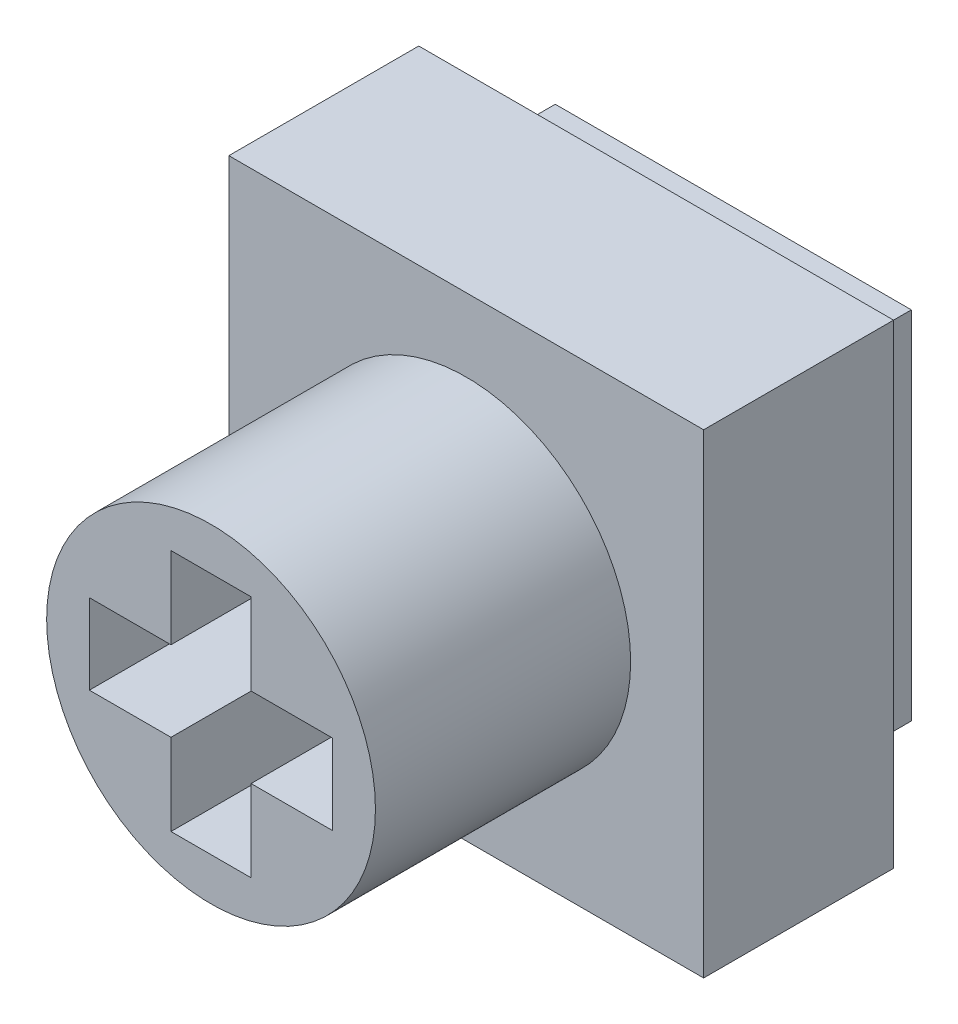
from build123d import *

# Parameters (mm, degrees)
BOSS_EXTRUDE1_DEPTH = 7.5
SKETCH7_W           = 8
SKETCH7_H           = 8
BOSS_EXTRUDE2_DEPTH = 3.2
SKETCH8_W           = 6
SKETCH8_H           = 6
BOSS_EXTRUDE3_DEPTH = 1.3


with BuildPart() as part:
    # Sketch6 → Boss-Extrude1 (new body)
    with BuildSketch(Plane(origin=(0, 4.132474232, 0), x_dir=(-1, 0, 0), z_dir=(0, 0, 1))):
        with BuildLine():
            ThreePointArc((-2.772388639, 27.198186003), (-1.961074426, 25.239500222), (-0.002388647, 24.428186003))
            ThreePointArc((-0.002388647, 24.428186003), (1.956297142, 25.239500216), (2.767611361, 27.198186003))
            ThreePointArc((2.767611361, 27.198186003), (1.956297145, 29.156871787), (-0.002388639, 29.968186003))
            ThreePointArc((-0.002388639, 29.968186003), (-1.961074423, 29.156871787), (-2.772388639, 27.198186003))
        make_face()
        Polygon((2.047611361, 27.873186003), (2.047611361, 26.523186003), (0.672611361, 26.523186003), (0.672611361, 25.148186003), (-0.677388639, 25.148186003), (-0.677388639, 26.523186003), (-2.052388639, 26.523186003), (-2.052388639, 27.873186003), (-0.677388639, 27.873186003), (-0.677388639, 29.248186003), (0.672611361, 29.248186003), (0.672611361, 27.873186003), align=None, mode=Mode.SUBTRACT)
    extrude(amount=BOSS_EXTRUDE1_DEPTH)

    # Sketch7 → Boss-Extrude2 (add)
    with BuildSketch(Plane(origin=(0, 0, 0), x_dir=(-1, 0, 0), z_dir=(0, 0, 1))):
        with Locations((-0.002388639, 23.065711771)):
            Rectangle(SKETCH7_W, SKETCH7_H)
    extrude(amount=BOSS_EXTRUDE2_DEPTH)

    # Sketch8 → Boss-Extrude3 (add)
    with BuildSketch(Plane(origin=(0, 0, 0), x_dir=(-1, 0, 0), z_dir=(0, 0, -1))):
        with Locations((-0.002388639, -23.065711771)):
            Rectangle(SKETCH8_W, SKETCH8_H)
    extrude(amount=BOSS_EXTRUDE3_DEPTH)


solid = part.part
